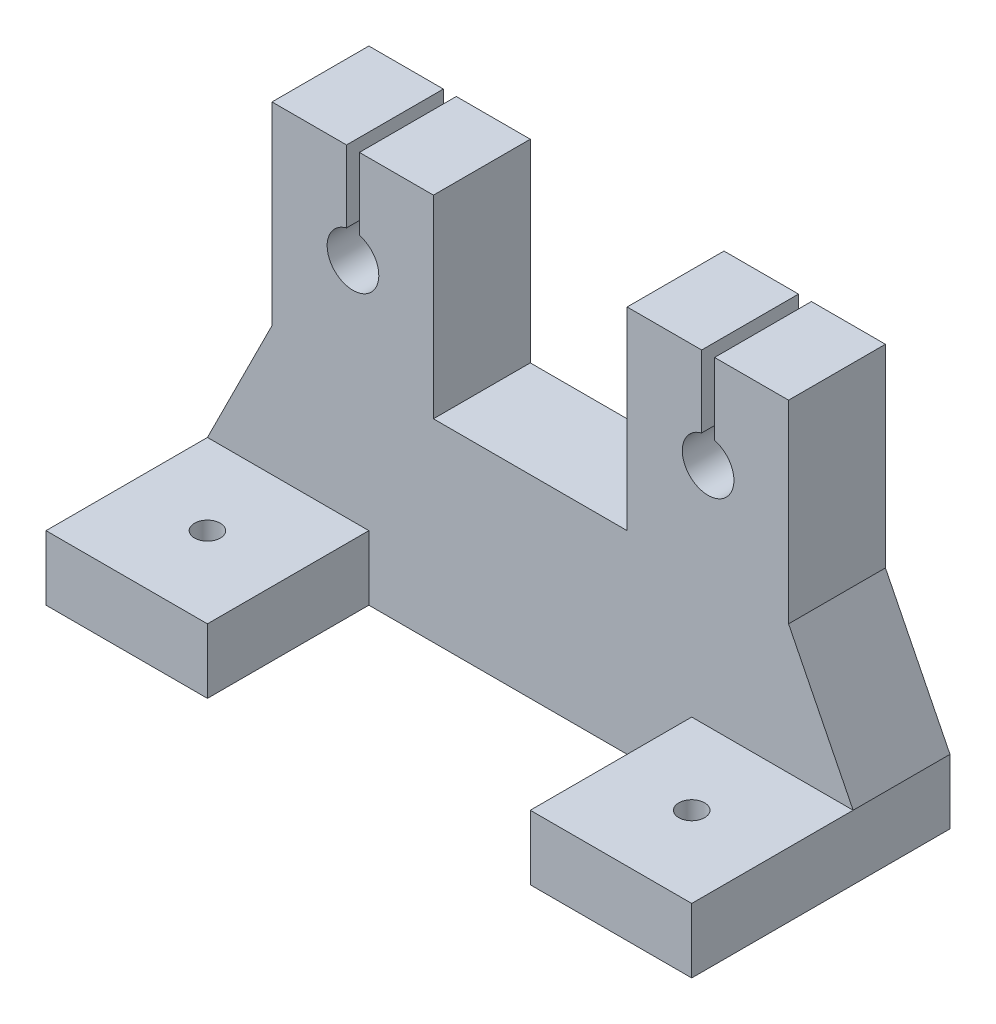
from build123d import *

# Parameters (mm, degrees)
BOSS_EXTRUDE1_DEPTH = 15
SKETCH2_W           = 25
SKETCH2_H           = 10
BOSS_EXTRUDE2_DEPTH = 25
SKETCH3_R           = 2
CUT_EXTRUDE1_DEPTH  = 10


with BuildPart() as part:
    # Sketch1 → Boss-Extrude1 (new body)
    with BuildSketch(Plane.XY):
        with BuildLine():
            Line((-15, 0), (0, 0))
            Line((0, 0), (15, 0))
            Line((15, 0), (15, 30))
            Line((15, 30), (26.540029545, 30))
            Line((26.540029545, 30), (26.540029545, 18.872983346))
            ThreePointArc((26.540029545, 18.872983346), (27.540029545, 11), (28.540029545, 18.872983346))
            Line((28.540029545, 18.872983346), (28.540029545, 30))
            Line((28.540029545, 30), (40, 30))
            Line((40, 30), (40, 0))
            Line((40, 0), (50, -20))
            Line((50, -20), (50, -30))
            Line((50, -30), (0, -30))
            Line((0, -30), (-50, -30))
            Line((-50, -30), (-50, -20))
            Line((-50, -20), (-40, 0))
            Line((-40, 0), (-40, 30))
            Line((-40, 30), (-28.459970455, 30))
            Line((-28.459970455, 30), (-28.459970455, 18.872983346))
            ThreePointArc((-28.459970455, 18.872983346), (-27.459970455, 11), (-26.459970455, 18.872983346))
            Line((-26.459970455, 18.872983346), (-26.459970455, 30))
            Line((-26.459970455, 30), (-15, 30))
            Line((-15, 30), (-15, 0))
        make_face()
    extrude(amount=-BOSS_EXTRUDE1_DEPTH)

    # Sketch2 → Boss-Extrude2 (add)
    with BuildSketch(Plane.XY):
        with Locations((-37.5, -25)):
            Rectangle(SKETCH2_W, SKETCH2_H)
        with Locations((37.5, -25)):
            Rectangle(SKETCH2_W, SKETCH2_H)
    extrude(amount=BOSS_EXTRUDE2_DEPTH)

    # Sketch3 → Cut-Extrude1 (cut)
    with BuildSketch(Plane(origin=(0, -20, 0), x_dir=(1, 0, 0), z_dir=(0, 1, 0))):
        with Locations(Location((-37.5, -12.5, 0), (0, 0, 270))):
            Circle(SKETCH3_R)
        with Locations(Location((37.5, -12.5, 0), (0, 0, 270))):
            Circle(SKETCH3_R)
    extrude(amount=-CUT_EXTRUDE1_DEPTH, mode=Mode.SUBTRACT)


solid = part.part
